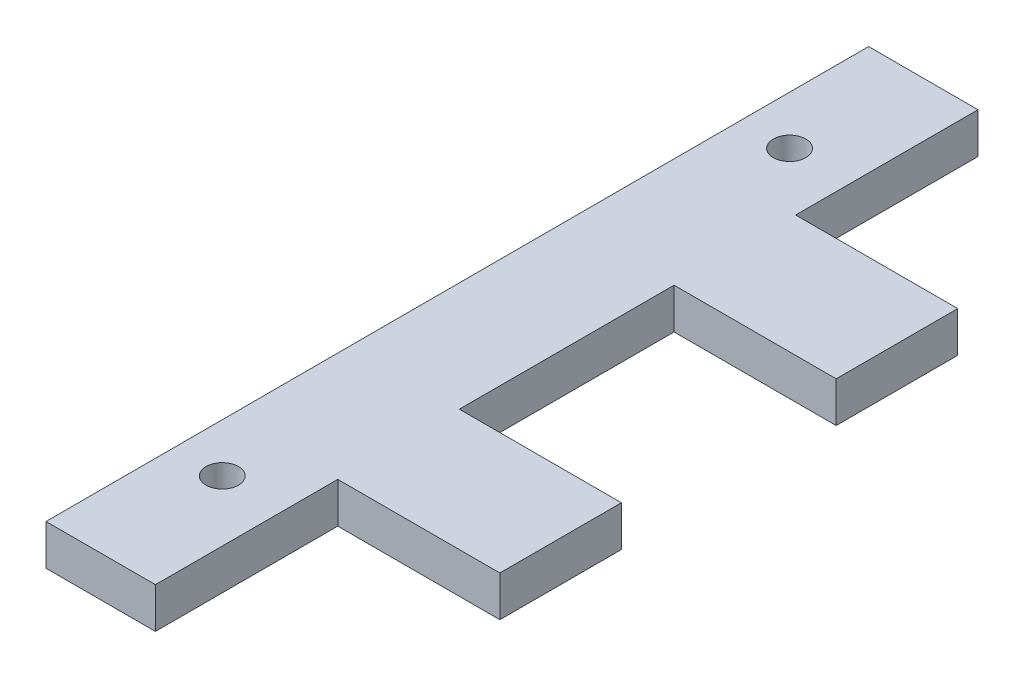
from build123d import *

# Parameters (mm, degrees)
SKETCH_1_R      = 0.4
EXTRUDE_1_DEPTH = 1


with BuildPart() as part:
    # Эскиз1 → Бобышка-Вытянуть1 (new body)
    with BuildSketch(Plane(origin=(0, 0, 0), x_dir=(1, 0, 0), z_dir=(0, 1, 0))):
        Polygon((2.7, 0), (0, 0), (0, -20.3), (2.7, -20.3), (2.7, -15.8), (6.7, -15.8), (6.7, -12.8), (2.7, -12.8), (2.7, -7.5), (6.7, -7.5), (6.7, -4.5), (2.7, -4.5), align=None)
        with Locations((1.2, -17.15)):
            Circle(SKETCH_1_R, mode=Mode.SUBTRACT)
        with Locations((1.2, -3.15)):
            Circle(SKETCH_1_R, mode=Mode.SUBTRACT)
    extrude(amount=EXTRUDE_1_DEPTH)


solid = part.part
